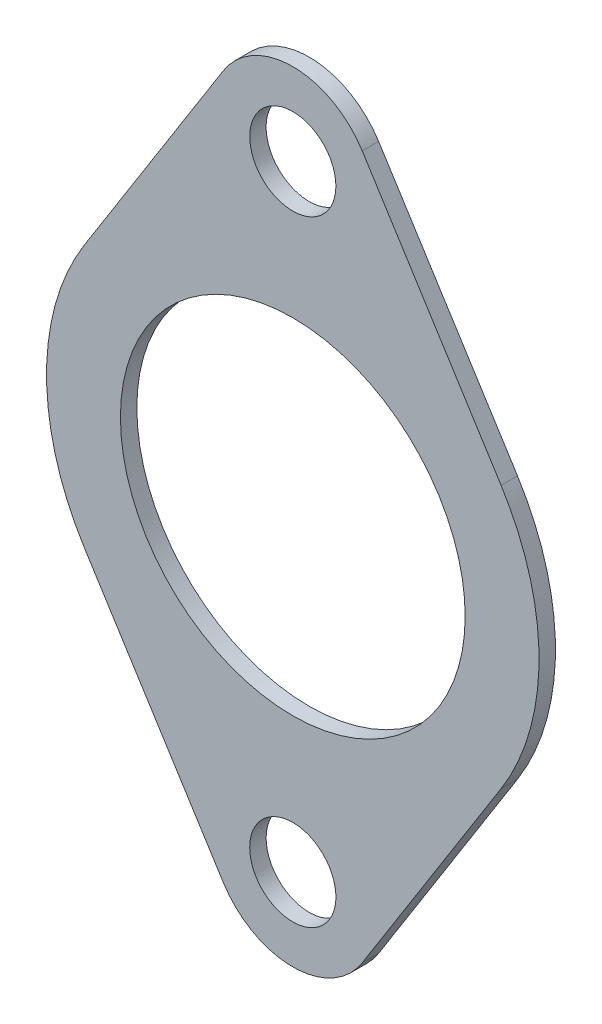
from build123d import *

# Parameters (mm, degrees)
SKETCH3_R           = 5.25
SKETCH3_R_2         = 21
BOSS_EXTRUDE1_DEPTH = 2


with BuildPart() as part:
    # Sketch3 → Boss-Extrude1 (new body)
    with BuildSketch(Plane.XY):
        with BuildLine():
            Line((8.459051694, 42.833333333), (25.377155081, 16))
            ThreePointArc((25.377155081, 16), (30, 0), (25.377155081, -16))
            Line((25.377155081, -16), (8.459051694, -42.833333333))
            ThreePointArc((8.459051694, -42.833333333), (0, -47.5), (-8.459051694, -42.833333333))
            Line((-8.459051694, -42.833333333), (-25.377155081, -16))
            ThreePointArc((-25.377155081, -16), (-30, 0), (-25.377155081, 16))
            Line((-25.377155081, 16), (-8.459051694, 42.833333333))
            ThreePointArc((-8.459051694, 42.833333333), (0, 47.5), (8.459051694, 42.833333333))
        make_face()
        with Locations((0, 37.5)):
            Circle(SKETCH3_R, mode=Mode.SUBTRACT)
        Circle(SKETCH3_R_2, mode=Mode.SUBTRACT)
        with Locations(Location((0, -37.5, 0), (0, 0, 180))):
            Circle(SKETCH3_R, mode=Mode.SUBTRACT)
    extrude(amount=BOSS_EXTRUDE1_DEPTH)


solid = part.part
